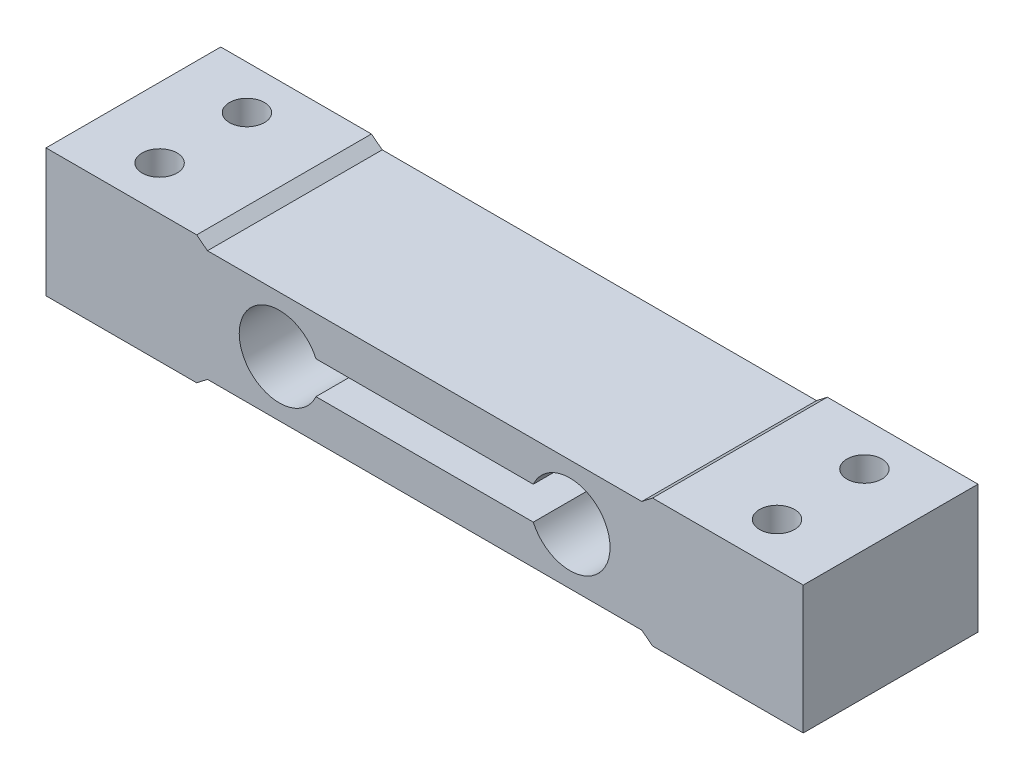
from build123d import *

# Parameters (mm, degrees)
BOSS_EXTRUDE1_DEPTH = 15
SKETCH5_R           = 3
CUT_EXTRUDE1_DEPTH  = 71.242437315


with BuildPart() as part:
    # Sketch2 → Boss-Extrude1 (new, symmetric)
    with BuildSketch(Plane.XY):
        Polygon((-65, 11), (-65, -11), (-39.13, -11), (-37.28, -9.565), (37.28, -9.565), (39.13, -11), (65, -11), (65, 11), (39.13, 11), (37.28, 9.565), (-37.28, 9.565), (-39.13, 11), align=None)
        with BuildLine():
            Line((0, 2.815), (18.655, 2.815))
            ThreePointArc((18.655, 2.815), (31.83, 0), (18.655, -2.815))
            Line((18.655, -2.815), (0, -2.815))
            Line((0, -2.815), (-18.655, -2.815))
            ThreePointArc((-18.655, -2.815), (-31.83, 0), (-18.655, 2.815))
            Line((-18.655, 2.815), (0, 2.815))
        make_face(mode=Mode.SUBTRACT)
    extrude(amount=BOSS_EXTRUDE1_DEPTH, both=True)

    # Sketch5 → Cut-Extrude1 (cut, through all)
    with BuildSketch(Plane(origin=(0, 11, 0), x_dir=(1, 0, 0), z_dir=(0, 1, 0))):
        with Locations(Location((-53, 7.5, 0), (0, 0, 270))):
            Circle(SKETCH5_R)
        with Locations(Location((-53, -7.5, 0), (0, 0, 90))):
            Circle(SKETCH5_R)
        with Locations(Location((53, -7.5, 0), (0, 0, 270))):
            Circle(SKETCH5_R)
        with Locations(Location((53, 7.5, 0), (0, 0, 90))):
            Circle(SKETCH5_R)
    extrude(amount=-CUT_EXTRUDE1_DEPTH, mode=Mode.SUBTRACT)


solid = part.part
